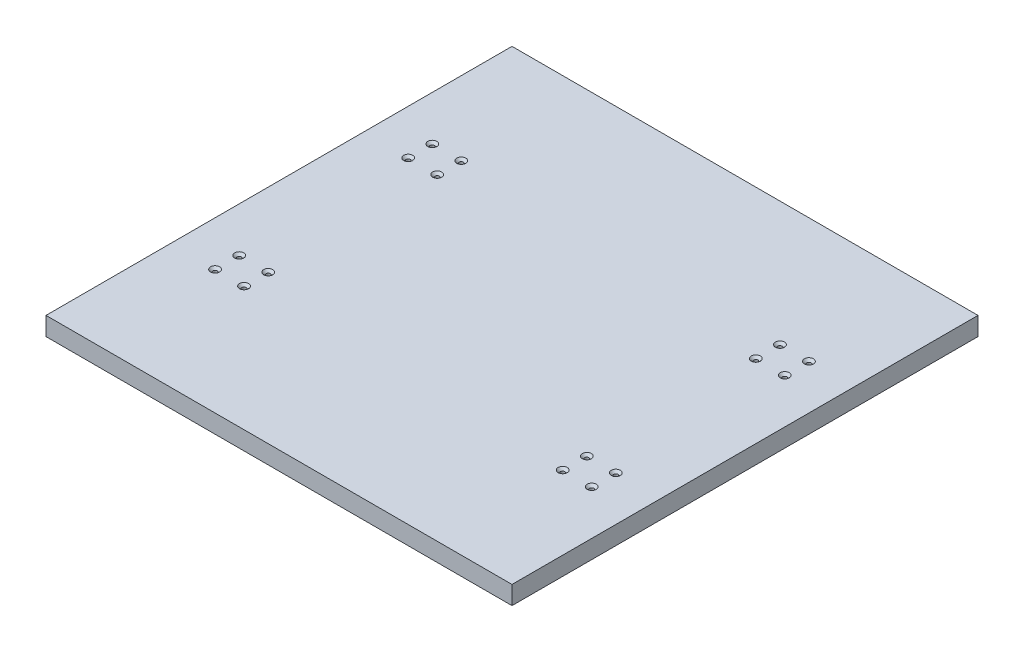
from build123d import *

# Parameters (mm, degrees)
SKETCH1_W                                       = 482.6
SKETCH1_H                                       = 482.6
BOSS_EXTRUDE1_DEPTH                             = 19.05
CSK_FOR_M4_FLAT_HEAD_MACHINE_SCREW1_D           = 4.5
CSK_FOR_M4_FLAT_HEAD_MACHINE_SCREW1_CSINK_D     = 9.4
CSK_FOR_M4_FLAT_HEAD_MACHINE_SCREW1_CSINK_ANGLE = 90


with BuildPart() as part:
    # Sketch1 → Boss-Extrude1 (new body)
    with BuildSketch(Plane(origin=(0, 0, 0), x_dir=(1, 0, 0), z_dir=(0, 1, 0))):
        Rectangle(SKETCH1_W, SKETCH1_H)
    extrude(amount=BOSS_EXTRUDE1_DEPTH)

    # CSK for M4 Flat Head Machine Screw1 (through all)
    with Locations(Plane(origin=(0, 19.05, 0), x_dir=(1, 0, 0), z_dir=(0, 1, 0))):
        with Locations((-195, -87.5), (-165, -87.5), (-165, -112.5), (-195, -112.5), (195, -112.5), (165, -112.5), (165, -87.5), (195, -87.5), (195, 87.5), (195, 112.5), (165, 112.5), (165, 87.5), (-195, 87.5), (-165, 87.5), (-165, 112.5), (-195, 112.5)):
            CounterSinkHole(CSK_FOR_M4_FLAT_HEAD_MACHINE_SCREW1_D / 2, CSK_FOR_M4_FLAT_HEAD_MACHINE_SCREW1_CSINK_D / 2, counter_sink_angle=CSK_FOR_M4_FLAT_HEAD_MACHINE_SCREW1_CSINK_ANGLE)


solid = part.part
